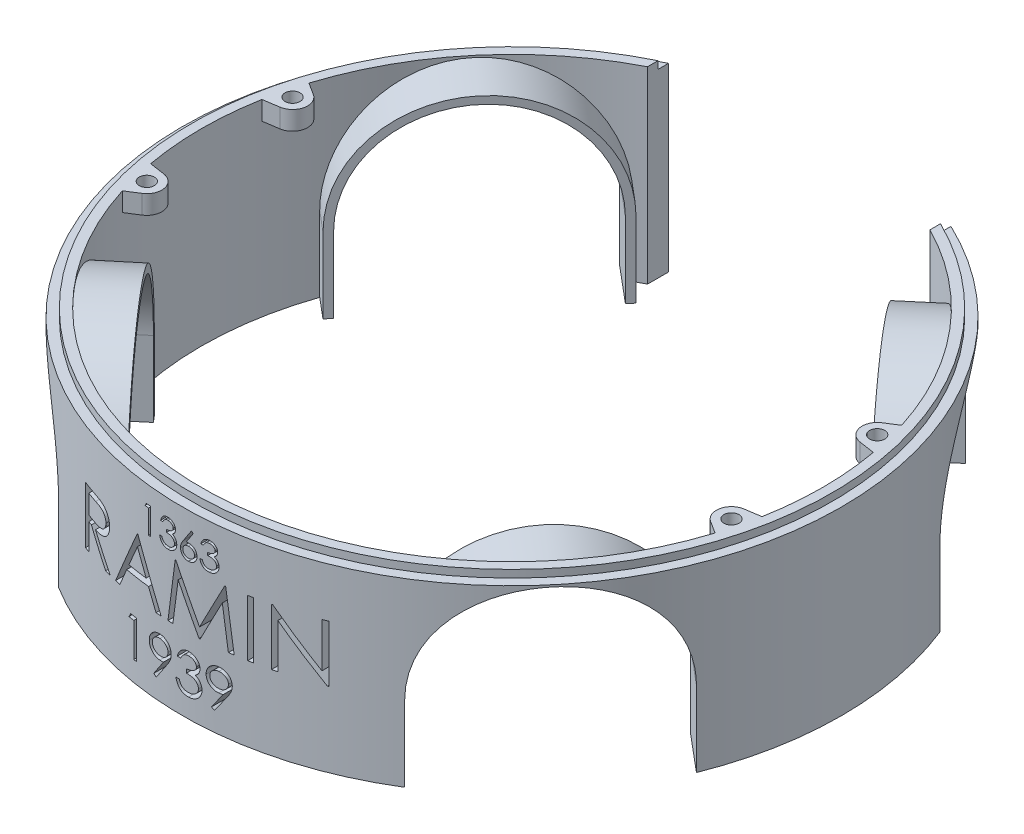
from build123d import *

# Parameters (mm, degrees)
SKETCH1_R                                     = 87.5
BOSS_EXTRUDE1_DEPTH                           = 50
SKETCH3_R                                     = 82.5
CUT_EXTRUDE1_DEPTH                            = 50
SKETCH6_W                                     = 75
SKETCH6_H                                     = 80.665083436
CUT_EXTRUDE2_DEPTH                            = 50
SKETCH7_R                                     = 2
BOSS_EXTRUDE10_DEPTH                          = 5
MIRROR1_AT_THE_SECOND_PLANE_COPY_1_SKETC_R    = 2
MIRROR1_AT_THE_SECOND_PLANE_COPY_1_DEPTH      = 5
CUT_EXTRUDE3_DEPTH                            = 134.46347815
BOSS_EXTRUDE11_REACH                          = 201.927
BOSS_EXTRUDE11_END_RADIUS                     = 82.5
MIRROR2_AT_THE_SECOND_PLANE_COPY_1_DEPTH      = 134.46347815
MIRROR2_AT_THE_SECOND_PLANE_COPY_2_REACH      = 201.927
MIRROR2_AT_THE_SECOND_PLANE_COPY_2_END_RADIUS = 82.5
CUT_EXTRUDE4_START                            = -2
SKETCH13_R                                    = 87.5
SKETCH13_R_2                                  = 85
CUT_EXTRUDE4_DEPTH                            = 2
SKETCH16_W                                    = 1.346153846
SKETCH16_H                                    = 15
CUT_EXTRUDE9_DEPTH                            = 10000


with BuildPart() as part:
    # Sketch1 → Boss-Extrude1 (new body)
    with BuildSketch(Plane(origin=(0, 0, 0), x_dir=(1, 0, 0), z_dir=(0, 1, 0))):
        with Locations(Location((0, 0, 0), (0, 0, 270))):
            Circle(SKETCH1_R)
    extrude(amount=BOSS_EXTRUDE1_DEPTH)

    # Sketch3 → Cut-Extrude1 (cut)
    with BuildSketch(Plane(origin=(0, 50, 0), x_dir=(1, 0, 0), z_dir=(0, 1, 0))):
        with Locations(Location((0, 0, 0), (0, 0, 270))):
            Circle(SKETCH3_R)
    extrude(amount=-CUT_EXTRUDE1_DEPTH, mode=Mode.SUBTRACT)

    # Sketch6 → Cut-Extrude2 (cut)
    with BuildSketch(Plane(origin=(0, 50, 0), x_dir=(1, 0, 0), z_dir=(0, 1, 0))):
        with Locations((0, 79.056941504)):
            Rectangle(SKETCH6_W, SKETCH6_H)
    extrude(amount=-CUT_EXTRUDE2_DEPTH, mode=Mode.SUBTRACT)

    # Sketch7 → Boss-Extrude10 (add)
    with BuildSketch(Plane(origin=(0, 50, 0), x_dir=(1, 0, 0), z_dir=(0, 1, 0))):
        with BuildLine():
            Line((-77.02286612, 15.399127899), (-81.167181464, 14.769517704))
            ThreePointArc((-81.167181464, 14.769517704), (-80.086745592, 19.808159443), (-78.693843423, 24.769517704))
            Line((-78.693843423, 24.769517704), (-75.481017933, 22.731486556))
            ThreePointArc((-75.481017933, 22.731486556), (-73.709264681, 18.530633102), (-77.02286612, 15.399127899))
        make_face()
        with Locations(Location((-77.623658102, 19.353751648, 0), (0, 0, 270))):
            Circle(SKETCH7_R, mode=Mode.SUBTRACT)
    boss_extrude10 = extrude(amount=-BOSS_EXTRUDE10_DEPTH)

    # Mirror1: Boss-Extrude10 across plane
    add(boss_extrude10.mirror(Plane(origin=(0, 0, 0), x_dir=(0, 0, 1), z_dir=(1, 0, 0))))

    # Mirror1 at the second plane: Boss-Extrude10 across plane
    add(boss_extrude10.mirror(Plane.XY))

    # Mirror1 at the second plane copy 1 sketc → Mirror1 at the second plane copy 1 (add)
    with BuildSketch(Plane(origin=(0, 50, 0), x_dir=(-1, 0, 0), z_dir=(0, 1, 0))):
        with BuildLine():
            Line((-77.02286612, 15.399127899), (-81.167181464, 14.769517704))
            ThreePointArc((-81.167181464, 14.769517704), (-80.086745592, 19.808159443), (-78.693843423, 24.769517704))
            Line((-78.693843423, 24.769517704), (-75.481017933, 22.731486556))
            ThreePointArc((-75.481017933, 22.731486556), (-73.709264681, 18.530633102), (-77.02286612, 15.399127899))
        make_face()
        with Locations(Location((-77.623658102, 19.353751648, 0), (0, 0, 270))):
            Circle(MIRROR1_AT_THE_SECOND_PLANE_COPY_1_SKETC_R, mode=Mode.SUBTRACT)
    extrude(amount=-MIRROR1_AT_THE_SECOND_PLANE_COPY_1_DEPTH)

    # Sketch9 → Cut-Extrude3 (cut, through all)
    with BuildSketch(Plane(origin=(0, 0, 0), x_dir=(0, 1, 0), z_dir=(0.7660444431189792, 0, 0.6427876096865379))):
        with BuildLine():
            Line((20, 27.5), (0, 27.5))
            Line((0, 27.5), (0, -27.5))
            Line((0, -27.5), (20, -27.5))
            ThreePointArc((20, -27.5), (47.5, 0), (20, 27.5))
        make_face()
    cut_extrude3 = extrude(amount=-CUT_EXTRUDE3_DEPTH, mode=Mode.SUBTRACT)

    # Boss-Extrude11: up to this cylinder (the profile starts inside it)
    boss_extrude11_end = Plane(origin=(0, 10, 0), z_dir=(0, 1, 0)) * Cylinder(BOSS_EXTRUDE11_END_RADIUS, 569.854, mode=Mode.PRIVATE)
    # Sketch10 → Boss-Extrude11 (add, up to the surface)
    with BuildSketch(Plane(origin=(-53.623111018, 0, -44.995132678), x_dir=(0, 1, 0), z_dir=(0.7660444431189792, 0, 0.6427876096865379)), mode=Mode.PRIVATE) as boss_extrude11_sk1:
        with BuildLine():
            Line((20, -27.5), (0, -27.5))
            Line((0, -27.5), (0, -29.5))
            Line((0, -29.5), (20, -29.5))
            ThreePointArc((20, -29.5), (49.5, 0), (20, 29.5))
            Line((20, 29.5), (0, 29.5))
            Line((0, 29.5), (0, 27.5))
            Line((0, 27.5), (20, 27.5))
            ThreePointArc((20, 27.5), (47.5, 0), (20, -27.5))
        make_face()
    boss_extrude11_tool1 = extrude(boss_extrude11_sk1.sketch, amount=-BOSS_EXTRUDE11_REACH, mode=Mode.PRIVATE) & boss_extrude11_end
    boss_extrude11 = boss_extrude11_tool1.solids().sort_by_distance((-72.090305, 10, -22.986788))[0]
    add(boss_extrude11)

    # Mirror2: Cut-Extrude3, Boss-Extrude11 across plane
    add(cut_extrude3.mirror(Plane.XY), mode=Mode.SUBTRACT)
    add(boss_extrude11.mirror(Plane.XY))

    # Mirror2 at the second plane: Cut-Extrude3, Boss-Extrude11 across plane
    add(cut_extrude3.mirror(Plane(origin=(0, 0, 0), x_dir=(0, 0, 1), z_dir=(1, 0, 0))), mode=Mode.SUBTRACT)
    add(boss_extrude11.mirror(Plane(origin=(0, 0, 0), x_dir=(0, 0, 1), z_dir=(1, 0, 0))))

    # Mirror2 at the second plane copy 1 sketc → Mirror2 at the second plane copy 1 (cut, through all)
    with BuildSketch(Plane(origin=(0, 0, 0), x_dir=(0, 1, 0), z_dir=(-0.7660444431189792, 0, -0.6427876096865379))):
        with BuildLine():
            Line((20, 27.5), (0, 27.5))
            Line((0, 27.5), (0, -27.5))
            Line((0, -27.5), (20, -27.5))
            ThreePointArc((20, -27.5), (47.5, 0), (20, 27.5))
        make_face()
    extrude(amount=-MIRROR2_AT_THE_SECOND_PLANE_COPY_1_DEPTH, mode=Mode.SUBTRACT)

    # Mirror2 at the second plane copy 2: up to this cylinder (the profile starts inside it)
    mirror2_at_the_second_plane_copy_2_end = Plane(origin=(0, 10, 0), z_dir=(0, 1, 0)) * Cylinder(MIRROR2_AT_THE_SECOND_PLANE_COPY_2_END_RADIUS, 569.854, mode=Mode.PRIVATE)
    # Mirror2 at the second plane copy 2 sketc → Mirror2 at the second plane copy 2 (add, up to the surface)
    with BuildSketch(Plane(origin=(53.623111018, 0, 44.995132678), x_dir=(0, 1, 0), z_dir=(-0.7660444431189792, 0, -0.6427876096865379)), mode=Mode.PRIVATE) as mirror2_at_the_second_plane_copy_2_sk1:
        with BuildLine():
            Line((20, -27.5), (0, -27.5))
            Line((0, -27.5), (0, -29.5))
            Line((0, -29.5), (20, -29.5))
            ThreePointArc((20, -29.5), (49.5, 0), (20, 29.5))
            Line((20, 29.5), (0, 29.5))
            Line((0, 29.5), (0, 27.5))
            Line((0, 27.5), (20, 27.5))
            ThreePointArc((20, 27.5), (47.5, 0), (20, -27.5))
        make_face()
    mirror2_at_the_second_plane_copy_2_tool1 = extrude(mirror2_at_the_second_plane_copy_2_sk1.sketch, amount=-MIRROR2_AT_THE_SECOND_PLANE_COPY_2_REACH, mode=Mode.PRIVATE) & mirror2_at_the_second_plane_copy_2_end
    add(mirror2_at_the_second_plane_copy_2_tool1.solids().sort_by_distance((-72.090305, 10, -22.986788))[0])

    # Sketch13 → Cut-Extrude4 (cut)
    with BuildSketch(Plane(origin=(0, 50, 0), x_dir=(1, 0, 0), z_dir=(0, 1, 0)).offset(CUT_EXTRUDE4_START)):
        Circle(SKETCH13_R)
        Circle(SKETCH13_R_2, mode=Mode.SUBTRACT)
    extrude(amount=CUT_EXTRUDE4_DEPTH, mode=Mode.SUBTRACT)

    # Sketch16 → Cut-Extrude9 (cut)
    # profile 1 of 13: a face of its own
    with BuildSketch(Plane.XY):
        with BuildLine():
            Line((-31.63045144, 34.8737665), (-28.628648556, 34.8737665))
            add(Edge.make_bspline(
                [(-28.628648556, 34.8737665), (-28.428329433, 34.873099703), (-28.043694529, 34.871819379), (-27.492666227, 34.864680395), (-26.991978669, 34.84421887), (-26.541893643, 34.826610655), (-26.142419407, 34.794502335), (-25.792331018, 34.763813848), (-25.493240886, 34.723641016), (-25.312187238, 34.68633206), (-25.230211056, 34.669439577)],
                knots=[0, 0, 0, 0, 1.410062039, 2.707475311, 3.878576406, 4.937260626, 5.877586885, 6.699081471, 7.410979367, 8, 8, 8, 8], degree=3))
            add(Edge.make_bspline(
                [(-25.230211056, 34.669439577), (-25.120468381, 34.642324868), (-24.90332414, 34.588673881), (-24.590681, 34.475275592), (-24.292762469, 34.344048629), (-24.010806079, 34.189918399), (-23.746224116, 34.011740772), (-23.496288499, 33.812591676), (-23.259865084, 33.593560794), (-23.046515241, 33.349125759), (-22.845347876, 33.092683575), (-22.675682334, 32.81538176), (-22.529425992, 32.525403785), (-22.41298092, 32.219800566), (-22.319218176, 31.901535829), (-22.253105722, 31.5677267), (-22.213457775, 31.21989395), (-22.209421251, 30.982645769), (-22.207374517, 30.862348231)],
                knots=[0, 0, 0, 0, 1.027469482, 2.033020251, 3.019912614, 3.986113645, 4.951240523, 5.91722682, 6.890402269, 7.87763091, 8.8651537, 9.85103654, 10.82876324, 11.815024772, 12.821070561, 13.842952187, 14.906261191, 16, 16, 16, 16], degree=3))
            add(Edge.make_bspline(
                [(-22.207374517, 30.862348231), (-22.213670223, 30.662483497), (-22.225954777, 30.272495634), (-22.340490935, 29.706520428), (-22.528104591, 29.178566223), (-22.786632973, 28.689297775), (-23.115859297, 28.248252152), (-23.511536973, 27.860864486), (-23.973886737, 27.536693432), (-24.404298091, 27.311895698), (-24.784501804, 27.167926089), (-25.097501716, 27.066627408), (-25.438931619, 26.988361843), (-25.805520196, 26.918246992), (-26.198793006, 26.865311159), (-26.61780746, 26.82654004), (-27.062862396, 26.802308403), (-27.368601264, 26.79869981), (-27.525884132, 26.796843423)],
                knots=[0, 0, 0, 0, 1.260483769, 2.459530307, 3.627416485, 4.787058657, 5.939039949, 7.08810263, 8.267026773, 9.491475466, 10.141966685, 10.831826277, 11.566392101, 12.351337768, 13.187381173, 14.07005841, 15.007169909, 16, 16, 16, 16], degree=3))
            Line((-27.525884132, 26.796843423), (-22.015066825, 19.8737665))
            Line((-22.015066825, 19.8737665), (-23.679730286, 19.8737665))
            Line((-23.679730286, 19.8737665), (-29.190547594, 26.796843423))
            Line((-29.190547594, 26.796843423), (-30.284297594, 26.796843423))
            Line((-30.284297594, 26.796843423), (-30.284297594, 19.8737665))
            Line((-30.284297594, 19.8737665), (-31.63045144, 19.8737665))
            Line((-31.63045144, 19.8737665), (-31.63045144, 34.8737665))
        make_face()
        with BuildLine():
            Line((-30.284297594, 33.335304962), (-30.284297594, 28.335304962))
            Line((-30.284297594, 28.335304962), (-27.537903363, 28.314271308))
            add(Edge.make_bspline(
                [(-27.537903363, 28.314271308), (-27.409674625, 28.314214579), (-27.161130809, 28.314104623), (-26.801556531, 28.331220807), (-26.466756052, 28.350692171), (-26.158009972, 28.38047508), (-25.875180363, 28.418858245), (-25.618408592, 28.466871035), (-25.387275513, 28.522808446), (-25.117710348, 28.609386842), (-24.816696642, 28.746555492), (-24.489561814, 28.946121915), (-24.210980367, 29.197132426), (-23.9756181, 29.484161523), (-23.786491965, 29.799745447), (-23.653154589, 30.140101315), (-23.568544122, 30.496636735), (-23.558564641, 30.741685768), (-23.553528363, 30.865353039)],
                knots=[0, 0, 0, 0, 1.146690395, 2.22261258, 3.21895312, 4.145990853, 4.996080663, 5.770904154, 6.481378293, 7.121626537, 8.300444488, 9.431385265, 10.535395872, 11.636531494, 12.74115979, 13.810798291, 14.895190096, 16, 16, 16, 16], degree=3))
            add(Edge.make_bspline(
                [(-23.553528363, 30.865353039), (-23.558680311, 30.985981212), (-23.568889591, 31.225022235), (-23.652241456, 31.574976136), (-23.793195947, 31.905263065), (-23.983148396, 32.214539429), (-24.214573346, 32.495278297), (-24.4859354, 32.735480382), (-24.789814808, 32.933692373), (-25.073834229, 33.060354004), (-25.32769514, 33.138010518), (-25.548107969, 33.192658363), (-25.797157159, 33.23656323), (-26.076051982, 33.271740633), (-26.383601828, 33.301976109), (-26.721361761, 33.322340874), (-27.087090819, 33.334400292), (-27.340577667, 33.334996387), (-27.471797594, 33.335304962)],
                knots=[0, 0, 0, 0, 1.101028733, 2.181837193, 3.264309656, 4.369019818, 5.486613113, 6.575447106, 7.666700264, 8.788928104, 9.402425223, 10.0903467, 10.862060571, 11.710948788, 12.657782767, 13.684531032, 14.801375019, 16, 16, 16, 16], degree=3))
            Line((-27.471797594, 33.335304962), (-30.284297594, 33.335304962))
        make_face(mode=Mode.SUBTRACT)
    # profile 2 of 13: a face of its own
    with BuildSketch(Plane.XY):
        Polygon((-12.784297594, 34.8737665), (-5.861220671, 19.8737665), (-7.324562017, 19.8737665), (-9.542110094, 24.681458808), (-16.341989902, 24.681458808), (-18.62263894, 19.8737665), (-20.091989902, 19.8737665), (-12.976605286, 34.8737665), align=None)
        Polygon((-12.895475479, 31.950088615), (-15.611821632, 26.219920346), (-10.251244709, 26.219920346), align=None, mode=Mode.SUBTRACT)
    # profile 3 of 13: a face of its own
    with BuildSketch(Plane.XY):
        Polygon((-3.938143748, 19.8737665), (-1.957975479, 34.8737665), (-1.765667786, 34.8737665), (4.427240868, 22.566074192), (10.605125483, 34.8737665), (10.800437983, 34.8737665), (12.792625483, 19.8737665), (11.440462021, 19.8737665), (10.004163944, 30.667035731), (4.589500483, 19.8737665), (4.286014906, 19.8737665), (-1.149682209, 30.691074192), (-2.582975479, 19.8737665), align=None)
    # profile 4 of 13: a face of its own
    with BuildSketch(Plane.XY):
        with Locations((16.542625483, 27.3737665)):
            Rectangle(SKETCH16_W, SKETCH16_H)
    # profile 5 of 13: a face of its own
    with BuildSketch(Plane.XY):
        Polygon((21.061856252, 19.8737665), (21.061856252, 34.8737665), (21.344308175, 34.8737665), (31.254163944, 23.067877077), (31.254163944, 34.8737665), (32.600317791, 34.8737665), (32.600317791, 19.8737665), (32.293827406, 19.8737665), (22.408010098, 31.652612654), (22.408010098, 19.8737665), align=None)
    # profile 6 of 13: a face of its own
    with BuildSketch(Plane.XY):
        Polygon((-10.1731322, 43.464122191), (-8.878861367, 43.464122191), (-8.878861367, 36.464122191), (-9.507066495, 36.464122191), (-9.507066495, 42.746173473), (-10.583989572, 42.746173473), align=None)
    # profile 7 of 13: a face of its own
    with BuildSketch(Plane.XY):
        with BuildLine():
            Line((-5.378861367, 41.848737575), (-6.007066495, 41.848737575))
            add(Edge.make_bspline(
                [(-6.007066495, 41.848737575), (-5.990047394, 41.919202543), (-5.956776442, 42.056955792), (-5.887381296, 42.253770314), (-5.811782785, 42.440017357), (-5.721004576, 42.612209504), (-5.621987068, 42.773807309), (-5.508541624, 42.921145558), (-5.385902179, 43.057971489), (-5.250252281, 43.179397964), (-5.107994957, 43.289353423), (-4.957125718, 43.383103538), (-4.800679931, 43.463751843), (-4.637573665, 43.530192307), (-4.467321321, 43.580243354), (-4.291462075, 43.616556966), (-4.109535074, 43.640139194), (-3.986039893, 43.64244072), (-3.923332521, 43.64360937)],
                knots=[0, 0, 0, 0, 1.162005537, 2.271625781, 3.343758855, 4.383309926, 5.390229558, 6.379919256, 7.361854164, 8.333198761, 9.295911338, 10.242430842, 11.177959212, 12.116337295, 13.062827104, 14.020064771, 14.994644689, 16, 16, 16, 16], degree=3))
            add(Edge.make_bspline(
                [(-3.923332521, 43.64360937), (-3.831967036, 43.64085091), (-3.651229015, 43.635394159), (-3.385702921, 43.585565286), (-3.129649282, 43.506715021), (-2.885870787, 43.397767567), (-2.659433922, 43.263392941), (-2.457961548, 43.103463467), (-2.284184527, 42.921064864), (-2.138395771, 42.719599735), (-2.024245773, 42.504288716), (-1.940073026, 42.282688402), (-1.888829664, 42.055324459), (-1.882188551, 41.901809901), (-1.878861367, 41.824899434)],
                knots=[0, 0, 0, 0, 1.083050992, 2.142477498, 3.193116406, 4.255571735, 5.30263384, 6.308962982, 7.297363603, 8.282367274, 9.249857812, 10.179914175, 11.08814088, 12, 12, 12, 12], degree=3))
            add(Edge.make_bspline(
                [(-1.878861367, 41.824899434), (-1.881188549, 41.750885845), (-1.885742483, 41.606052736), (-1.924409894, 41.394609742), (-1.98948242, 41.195326541), (-2.079621945, 41.007364217), (-2.196305046, 40.831914537), (-2.337650439, 40.668582756), (-2.504655763, 40.516644439), (-2.631213639, 40.429605493), (-2.69636938, 40.384795268)],
                knots=[0, 0, 0, 0, 1.024540389, 2.004866551, 2.965041327, 3.920577974, 4.882998113, 5.874504559, 6.905732034, 8, 8, 8, 8], degree=3))
            add(Edge.make_bspline(
                [(-2.69636938, 40.384795268), (-2.62190587, 40.348838925), (-2.474372122, 40.277599009), (-2.273271063, 40.137887494), (-2.090715312, 39.9765748), (-1.988907874, 39.850689494), (-1.937755598, 39.787439498)],
                knots=[0, 0, 0, 0, 1.015518401, 2.012035669, 3.001164323, 4, 4, 4, 4], degree=3))
            add(Edge.make_bspline(
                [(-1.937755598, 39.787439498), (-1.904072913, 39.741323995), (-1.837259121, 39.649848162), (-1.754788053, 39.50277531), (-1.679969825, 39.354072332), (-1.621669386, 39.19975352), (-1.576521652, 39.041607492), (-1.544249588, 38.8793627), (-1.524201306, 38.712886655), (-1.521330202, 38.600261695), (-1.519887008, 38.543649434)],
                knots=[0, 0, 0, 0, 1.025084078, 2.033381695, 3.024893161, 4.013698104, 4.991890475, 5.976764909, 6.982997093, 8, 8, 8, 8], degree=3))
            add(Edge.make_bspline(
                [(-1.519887008, 38.543649434), (-1.523476035, 38.445629992), (-1.530637199, 38.250052388), (-1.594645347, 37.961102945), (-1.693871829, 37.67865194), (-1.834785701, 37.408502262), (-2.006520718, 37.1557415), (-2.210835367, 36.929588882), (-2.445408184, 36.735191673), (-2.707019481, 36.572771217), (-2.990453738, 36.442935373), (-3.293604922, 36.352820487), (-3.61210503, 36.294128488), (-3.830519625, 36.28783475), (-3.941561687, 36.284635011)],
                knots=[0, 0, 0, 0, 0.955779014, 1.907060117, 2.875433937, 3.871313158, 4.872415639, 5.851225146, 6.836215519, 7.83643374, 8.849228613, 9.86973379, 10.916971861, 12, 12, 12, 12], degree=3))
            add(Edge.make_bspline(
                [(-3.941561687, 36.284635011), (-4.016400288, 36.286371438), (-4.163657698, 36.289788146), (-4.380144695, 36.313145349), (-4.586788093, 36.355805359), (-4.783867289, 36.41321197), (-4.971557362, 36.485995454), (-5.149285572, 36.57663285), (-5.318145359, 36.683255854), (-5.476543262, 36.80712303), (-5.624460397, 36.945685709), (-5.757965846, 37.101403729), (-5.879285431, 37.271398537), (-5.985170709, 37.457644649), (-6.080444614, 37.657735164), (-6.158806527, 37.874232161), (-6.227777665, 38.105200205), (-6.259844593, 38.266155685), (-6.276297264, 38.348737575)],
                knots=[0, 0, 0, 0, 1.048658725, 2.063410685, 3.046034179, 4.001477787, 4.936774919, 5.862367409, 6.792675028, 7.730719943, 8.675894397, 9.627829632, 10.600096036, 11.597688215, 12.626045268, 13.701542398, 14.82072376, 16, 16, 16, 16], degree=3))
            Line((-6.276297264, 38.348737575), (-5.648092136, 38.348737575))
            add(Edge.make_bspline(
                [(-5.648092136, 38.348737575), (-5.631725553, 38.294839549), (-5.599891128, 38.190003206), (-5.545702532, 38.039122594), (-5.483965988, 37.900806488), (-5.41773687, 37.774040244), (-5.348179978, 37.657575439), (-5.270350128, 37.554491701), (-5.190011838, 37.460261296), (-5.129453131, 37.407172073), (-5.099814892, 37.381189498)],
                knots=[0, 0, 0, 0, 1.198163088, 2.33053128, 3.407730985, 4.417276592, 5.372219308, 6.28897303, 7.162600585, 8, 8, 8, 8], degree=3))
            add(Edge.make_bspline(
                [(-5.099814892, 37.381189498), (-5.060621739, 37.350972831), (-4.982356414, 37.290632767), (-4.854819951, 37.21362951), (-4.720690179, 37.146907459), (-4.577060831, 37.095940068), (-4.42703129, 37.052784746), (-4.268176559, 37.024543708), (-4.101898125, 37.005167365), (-3.988362598, 37.003457502), (-3.930343739, 37.002583729)],
                knots=[0, 0, 0, 0, 0.946170439, 1.889420265, 2.845303464, 3.807233317, 4.801018734, 5.828864929, 6.890507805, 8, 8, 8, 8], degree=3))
            add(Edge.make_bspline(
                [(-3.930343739, 37.002583729), (-3.864836733, 37.00381554), (-3.736743439, 37.006224239), (-3.549833721, 37.028375652), (-3.372018826, 37.060636479), (-3.205272974, 37.110462445), (-3.047411959, 37.172024148), (-2.90064866, 37.249320959), (-2.763056448, 37.340010402), (-2.636397637, 37.443088719), (-2.522506622, 37.55593171), (-2.422227595, 37.673957852), (-2.336978272, 37.796669511), (-2.268211116, 37.924745753), (-2.213910015, 38.05765621), (-2.176943614, 38.195773869), (-2.151240584, 38.337968401), (-2.14914736, 38.434626339), (-2.148092136, 38.48335296)],
                knots=[0, 0, 0, 0, 1.217147791, 2.380027433, 3.494444702, 4.572153297, 5.609568379, 6.639424714, 7.649109417, 8.668170816, 9.669597737, 10.625200337, 11.543417969, 12.441394052, 13.322311151, 14.205496177, 15.095365482, 16, 16, 16, 16], degree=3))
            add(Edge.make_bspline(
                [(-2.148092136, 38.48335296), (-2.151152739, 38.548575638), (-2.157258716, 38.678696454), (-2.203875875, 38.870131603), (-2.280553603, 39.054578428), (-2.387898626, 39.228890008), (-2.518570083, 39.390441811), (-2.671299897, 39.534584776), (-2.847356354, 39.653524958), (-3.009396092, 39.735702271), (-3.152926405, 39.791776421), (-3.275757174, 39.82912635), (-3.41327038, 39.860753661), (-3.563803078, 39.890178204), (-3.728489511, 39.915220901), (-3.907150387, 39.936104532), (-4.09982191, 39.952814614), (-4.233204242, 39.960276805), (-4.30193829, 39.964122191)],
                knots=[0, 0, 0, 0, 1.07054697, 2.135767047, 3.216561865, 4.33974944, 5.486079747, 6.621378074, 7.775625952, 8.963672916, 9.598146892, 10.304877434, 11.070270905, 11.915000392, 12.823868403, 13.805723172, 14.86925407, 16, 16, 16, 16], degree=3))
            Line((-4.30193829, 39.964122191), (-4.30193829, 40.682070909))
            add(Edge.make_bspline(
                [(-4.30193829, 40.682070909), (-4.215335958, 40.683540516), (-4.045703265, 40.686419116), (-3.797914656, 40.721235137), (-3.560968031, 40.769396393), (-3.340114547, 40.843166778), (-3.138817121, 40.928847371), (-2.964177917, 41.02855179), (-2.818643622, 41.139381289), (-2.702921479, 41.263046507), (-2.615863022, 41.395676602), (-2.552209427, 41.533909918), (-2.514608774, 41.67895804), (-2.509589441, 41.777947376), (-2.507066495, 41.827703922)],
                knots=[0, 0, 0, 0, 1.321986639, 2.589447074, 3.816329219, 5.01088745, 6.139805852, 7.153945165, 8.075214402, 8.924034688, 9.728124013, 10.488707548, 11.240355623, 12, 12, 12, 12], degree=3))
            add(Edge.make_bspline(
                [(-2.507066495, 41.827703922), (-2.507895317, 41.864259412), (-2.509544219, 41.936984826), (-2.530338774, 42.043234963), (-2.561586856, 42.146236855), (-2.604546315, 42.245552476), (-2.662046712, 42.340493024), (-2.730858685, 42.431867921), (-2.812794886, 42.519155479), (-2.90668578, 42.600516119), (-3.00750939, 42.678054593), (-3.11800894, 42.743881867), (-3.234852689, 42.800171991), (-3.358169999, 42.846590995), (-3.48836106, 42.881509572), (-3.624814175, 42.906581254), (-3.767789542, 42.922256564), (-3.865333006, 42.924513396), (-3.914919059, 42.925660652)],
                knots=[0, 0, 0, 0, 0.884392785, 1.759457502, 2.611959086, 3.489218968, 4.37281399, 5.2945488, 6.255912374, 7.266815255, 8.301784654, 9.332968512, 10.37626691, 11.440494194, 12.520033166, 13.637162961, 14.798855837, 16, 16, 16, 16], degree=3))
            add(Edge.make_bspline(
                [(-3.914919059, 42.925660652), (-3.994622395, 42.922877928), (-4.150301548, 42.917442621), (-4.374731382, 42.869836594), (-4.58337005, 42.793880427), (-4.742847383, 42.703214388), (-4.860612531, 42.613713521), (-4.944766408, 42.535548748), (-5.027407428, 42.448683101), (-5.103098782, 42.34776635), (-5.179646735, 42.23963277), (-5.249335858, 42.118785407), (-5.317055243, 41.988376618), (-5.357860342, 41.896185349), (-5.378861367, 41.848737575)],
                knots=[0, 0, 0, 0, 1.472543308, 2.876219568, 4.221790263, 5.565193594, 6.249813518, 6.953379497, 7.687249741, 8.463570142, 9.283606569, 10.136032583, 11.040678096, 12, 12, 12, 12], degree=3))
        make_face()
    # profile 8 of 13: a face of its own
    with BuildSketch(Plane.XY):
        with BuildLine():
            Line((2.339087351, 43.64360937), (2.82286139, 43.263601357))
            Line((2.82286139, 43.263601357), (0.973302095, 40.435276037))
            add(Edge.make_bspline(
                [(0.973302095, 40.435276037), (1.096442649, 40.454903758), (1.336642222, 40.493189848), (1.579774019, 40.499505739), (1.698262031, 40.502583729)],
                knots=[0, 0, 0, 0, 1.025318673, 2, 2, 2, 2], degree=3))
            add(Edge.make_bspline(
                [(1.698262031, 40.502583729), (1.769407023, 40.500671506), (1.909453824, 40.496907351), (2.115067429, 40.46793965), (2.312645301, 40.422289426), (2.501368525, 40.355744914), (2.681914489, 40.270740205), (2.855319281, 40.168862465), (3.018323301, 40.044851104), (3.17302566, 39.906321192), (3.313479854, 39.752887223), (3.437831966, 39.59008455), (3.542285549, 39.418082788), (3.627033392, 39.236969056), (3.692843149, 39.047022537), (3.74081844, 38.848486258), (3.769177625, 38.641223315), (3.773028607, 38.500266964), (3.774984787, 38.42866546)],
                knots=[0, 0, 0, 0, 1.04369286, 2.054478336, 3.041073146, 4.015093852, 4.984733326, 5.965804835, 6.960378782, 7.985147595, 9.009457201, 10.008161701, 10.986880575, 11.956520048, 12.937015923, 13.931873656, 14.949455224, 16, 16, 16, 16], degree=3))
            add(Edge.make_bspline(
                [(3.774984787, 38.42866546), (3.772138577, 38.330706052), (3.76653791, 38.13794512), (3.710730318, 37.857191707), (3.624011029, 37.589726676), (3.500055972, 37.339820334), (3.346091206, 37.107815194), (3.15833602, 36.902244264), (2.943449044, 36.718904189), (2.700475447, 36.565590951), (2.438989519, 36.440384849), (2.164285524, 36.350454364), (1.879031232, 36.295087426), (1.685422016, 36.28814622), (1.587484787, 36.284635011)],
                knots=[0, 0, 0, 0, 1.031375318, 2.029502543, 3.004789286, 3.987476834, 4.960371455, 5.9300674, 6.912260825, 7.929083631, 8.949397511, 9.960523116, 10.96833055, 12, 12, 12, 12], degree=3))
            add(Edge.make_bspline(
                [(1.587484787, 36.284635011), (1.493291386, 36.287691423), (1.30671075, 36.293745639), (1.032245161, 36.347677515), (0.768519127, 36.43509172), (0.517380365, 36.555520277), (0.284739139, 36.707636043), (0.076607866, 36.890760601), (-0.105975683, 37.100979531), (-0.257924925, 37.338260226), (-0.378442389, 37.593240141), (-0.468822239, 37.859114454), (-0.521614725, 38.134914417), (-0.528991839, 38.321876696), (-0.532707521, 38.416045268)],
                knots=[0, 0, 0, 0, 1.012016664, 2.004627821, 2.994792927, 3.992885782, 4.990978636, 5.973936114, 6.964471063, 7.975201453, 8.993600317, 9.990122807, 10.98767138, 12, 12, 12, 12], degree=3))
            add(Edge.make_bspline(
                [(-0.532707521, 38.416045268), (-0.530344631, 38.488134434), (-0.525520061, 38.635326738), (-0.49183328, 38.858254794), (-0.43770369, 39.086356957), (-0.377083198, 39.279865345), (-0.313031978, 39.438388389), (-0.259726898, 39.56619537), (-0.193378906, 39.697717516), (-0.122632144, 39.837464788), (-0.041118406, 39.981835654), (0.047512893, 40.133242993), (0.145712194, 40.289278848), (0.21455252, 40.395167238), (0.249744402, 40.449298473)],
                knots=[0, 0, 0, 0, 1.173818275, 2.396712641, 3.66331629, 4.989737886, 5.693666774, 6.447286557, 7.243889047, 8.091586357, 8.998013824, 9.943181721, 10.948533338, 12, 12, 12, 12], degree=3))
            Line((0.249744402, 40.449298473), (2.339087351, 43.64360937))
        make_face()
        with BuildLine():
            add(Edge.make_bspline(
                [(1.566451133, 39.784635011), (1.513126644, 39.783078924), (1.408968425, 39.780039433), (1.256153595, 39.762388929), (1.111527092, 39.729150798), (0.973172825, 39.686818134), (0.843677419, 39.628612015), (0.72209974, 39.557908417), (0.607969636, 39.474666061), (0.502482532, 39.380064238), (0.406843206, 39.276488173), (0.324480944, 39.165549128), (0.253436144, 39.049920722), (0.195672506, 38.928636838), (0.150692355, 38.801743838), (0.118155853, 38.66982534), (0.10004835, 38.531996727), (0.097035887, 38.438531722), (0.095497608, 38.390804883)],
                knots=[0, 0, 0, 0, 1.129588631, 2.206414736, 3.251139165, 4.268635594, 5.265702196, 6.250456724, 7.242448911, 8.251968645, 9.246821453, 10.222880186, 11.173611482, 12.116736599, 13.062300278, 14.020270554, 14.989073742, 16, 16, 16, 16], degree=3))
            add(Edge.make_bspline(
                [(0.095497608, 38.390804883), (0.096750331, 38.343504923), (0.099206734, 38.250756744), (0.121511374, 38.114078385), (0.155581538, 37.982548568), (0.20626233, 37.85684537), (0.266716106, 37.735052734), (0.346526755, 37.621582163), (0.434960326, 37.509542023), (0.540668193, 37.40753908), (0.654114919, 37.312625832), (0.775317324, 37.229665325), (0.901637244, 37.158692978), (1.034780088, 37.103070783), (1.172856856, 37.057422209), (1.317017964, 37.025299251), (1.467363675, 37.007138199), (1.569207551, 37.004121811), (1.621138633, 37.002583729)],
                knots=[0, 0, 0, 0, 0.989467248, 1.94019797, 2.891935182, 3.827694429, 4.772920941, 5.730924762, 6.725747692, 7.756678648, 8.79901574, 9.819492441, 10.826891316, 11.826466727, 12.835195252, 13.867842842, 14.912794438, 16, 16, 16, 16], degree=3))
            add(Edge.make_bspline(
                [(1.621138633, 37.002583729), (1.67306963, 37.004121932), (1.774913339, 37.007138556), (1.92526026, 37.025297893), (2.069416897, 37.057427189), (2.207509914, 37.10305273), (2.340592777, 37.158759949), (2.46680222, 37.229223788), (2.586858407, 37.313136024), (2.700379606, 37.40737688), (2.805647482, 37.510122584), (2.89620204, 37.620582029), (2.973568507, 37.73596982), (3.036436881, 37.8563656), (3.086559463, 37.982624575), (3.120802398, 38.114058023), (3.143060976, 38.250762075), (3.145523708, 38.343506724), (3.146779659, 38.390804883)],
                knots=[0, 0, 0, 0, 1.087397944, 2.132534446, 3.165364764, 4.174271784, 5.174024072, 6.181601208, 7.194203697, 8.236725232, 9.267838612, 10.269026844, 11.221737037, 12.171628256, 13.107553087, 14.05945871, 15.010357665, 16, 16, 16, 16], degree=3))
            add(Edge.make_bspline(
                [(3.146779659, 38.390804883), (3.145679073, 38.438593985), (3.143518981, 38.53238845), (3.119087083, 38.669763686), (3.085202336, 38.802414099), (3.034036274, 38.929505997), (2.967563185, 39.050537851), (2.886596371, 39.166121053), (2.79293123, 39.277141748), (2.684736151, 39.380267365), (2.566955683, 39.47456152), (2.441724512, 39.557800633), (2.310708565, 39.628050587), (2.17404068, 39.686664791), (2.030154915, 39.728963739), (1.881374236, 39.762270226), (1.725795751, 39.779994261), (1.620242534, 39.783068391), (1.566451133, 39.784635011)],
                knots=[0, 0, 0, 0, 0.978206639, 1.919901502, 2.851605144, 3.780102724, 4.718870031, 5.675451981, 6.667674623, 7.690630536, 8.733308323, 9.756129687, 10.767539656, 11.776269907, 12.797430371, 13.836405707, 14.897401972, 16, 16, 16, 16], degree=3))
        make_face(mode=Mode.SUBTRACT)
    # profile 9 of 13: a face of its own
    with BuildSketch(Plane.XY):
        with BuildLine():
            Line((5.390369402, 41.848737575), (4.762164274, 41.848737575))
            add(Edge.make_bspline(
                [(4.762164274, 41.848737575), (4.779183376, 41.919202543), (4.812454327, 42.056955792), (4.881849474, 42.253770314), (4.957447984, 42.440017357), (5.048226193, 42.612209504), (5.147243702, 42.773807309), (5.260689145, 42.921145558), (5.38332859, 43.057971489), (5.518978488, 43.179397964), (5.661235812, 43.289353423), (5.812105051, 43.383103538), (5.968550839, 43.463751843), (6.131657104, 43.530192307), (6.301909448, 43.580243354), (6.477768695, 43.616556966), (6.659695695, 43.640139194), (6.783190876, 43.64244072), (6.845898249, 43.64360937)],
                knots=[0, 0, 0, 0, 1.162005537, 2.271625781, 3.343758855, 4.383309926, 5.390229558, 6.379919256, 7.361854164, 8.333198761, 9.295911338, 10.242430842, 11.177959212, 12.116337295, 13.062827104, 14.020064771, 14.994644689, 16, 16, 16, 16], degree=3))
            add(Edge.make_bspline(
                [(6.845898249, 43.64360937), (6.937263733, 43.64085091), (7.118001755, 43.635394159), (7.383527849, 43.585565286), (7.639581487, 43.506715021), (7.883359982, 43.397767567), (8.109796848, 43.263392941), (8.311269221, 43.103463467), (8.485046243, 42.921064864), (8.630834998, 42.719599735), (8.744984996, 42.504288716), (8.829157743, 42.282688402), (8.880401105, 42.055324459), (8.887042219, 41.901809901), (8.890369402, 41.824899434)],
                knots=[0, 0, 0, 0, 1.083050992, 2.142477498, 3.193116406, 4.255571735, 5.30263384, 6.308962982, 7.297363603, 8.282367274, 9.249857812, 10.179914175, 11.08814088, 12, 12, 12, 12], degree=3))
            add(Edge.make_bspline(
                [(8.890369402, 41.824899434), (8.88804222, 41.750885845), (8.883488286, 41.606052736), (8.844820875, 41.394609742), (8.779748349, 41.195326541), (8.689608824, 41.007364217), (8.572925724, 40.831914537), (8.43158033, 40.668582756), (8.264575006, 40.516644439), (8.13801713, 40.429605493), (8.07286139, 40.384795268)],
                knots=[0, 0, 0, 0, 1.024540389, 2.004866551, 2.965041327, 3.920577974, 4.882998113, 5.874504559, 6.905732034, 8, 8, 8, 8], degree=3))
            add(Edge.make_bspline(
                [(8.07286139, 40.384795268), (8.147324899, 40.348838925), (8.294858647, 40.277599009), (8.495959706, 40.137887494), (8.678515457, 39.9765748), (8.780322895, 39.850689494), (8.831475172, 39.787439498)],
                knots=[0, 0, 0, 0, 1.015518401, 2.012035669, 3.001164323, 4, 4, 4, 4], degree=3))
            add(Edge.make_bspline(
                [(8.831475172, 39.787439498), (8.865157856, 39.741323995), (8.931971649, 39.649848162), (9.014442716, 39.50277531), (9.089260945, 39.354072332), (9.147561383, 39.19975352), (9.192709117, 39.041607492), (9.224981181, 38.8793627), (9.245029463, 38.712886655), (9.247900567, 38.600261695), (9.249343761, 38.543649434)],
                knots=[0, 0, 0, 0, 1.025084078, 2.033381695, 3.024893161, 4.013698104, 4.991890475, 5.976764909, 6.982997093, 8, 8, 8, 8], degree=3))
            add(Edge.make_bspline(
                [(9.249343761, 38.543649434), (9.245754734, 38.445629992), (9.23859357, 38.250052388), (9.174585422, 37.961102945), (9.07535894, 37.67865194), (8.934445068, 37.408502262), (8.762710051, 37.1557415), (8.558395402, 36.929588882), (8.323822586, 36.735191673), (8.062211288, 36.572771217), (7.778777031, 36.442935373), (7.475625847, 36.352820487), (7.157125739, 36.294128488), (6.938711144, 36.28783475), (6.827669082, 36.284635011)],
                knots=[0, 0, 0, 0, 0.955779014, 1.907060117, 2.875433937, 3.871313158, 4.872415639, 5.851225146, 6.836215519, 7.83643374, 8.849228613, 9.86973379, 10.916971861, 12, 12, 12, 12], degree=3))
            add(Edge.make_bspline(
                [(6.827669082, 36.284635011), (6.752830481, 36.286371438), (6.605573071, 36.289788146), (6.389086074, 36.313145349), (6.182442676, 36.355805359), (5.98536348, 36.41321197), (5.797673407, 36.485995454), (5.619945197, 36.57663285), (5.45108541, 36.683255854), (5.292687508, 36.80712303), (5.144770372, 36.945685709), (5.011264924, 37.101403729), (4.889945338, 37.271398537), (4.78406006, 37.457644649), (4.688786155, 37.657735164), (4.610424242, 37.874232161), (4.541453105, 38.105200205), (4.509386176, 38.266155685), (4.492933505, 38.348737575)],
                knots=[0, 0, 0, 0, 1.048658725, 2.063410685, 3.046034179, 4.001477787, 4.936774919, 5.862367409, 6.792675028, 7.730719943, 8.675894397, 9.627829632, 10.600096036, 11.597688215, 12.626045268, 13.701542398, 14.82072376, 16, 16, 16, 16], degree=3))
            Line((4.492933505, 38.348737575), (5.121138633, 38.348737575))
            add(Edge.make_bspline(
                [(5.121138633, 38.348737575), (5.137505216, 38.294839549), (5.169339641, 38.190003206), (5.223528238, 38.039122594), (5.285264782, 37.900806488), (5.351493899, 37.774040244), (5.421050791, 37.657575439), (5.498880641, 37.554491701), (5.579218932, 37.460261296), (5.639777638, 37.407172073), (5.669415877, 37.381189498)],
                knots=[0, 0, 0, 0, 1.198163088, 2.33053128, 3.407730985, 4.417276592, 5.372219308, 6.28897303, 7.162600585, 8, 8, 8, 8], degree=3))
            add(Edge.make_bspline(
                [(5.669415877, 37.381189498), (5.70860903, 37.350972831), (5.786874356, 37.290632767), (5.914410818, 37.21362951), (6.04854059, 37.146907459), (6.192169938, 37.095940068), (6.342199479, 37.052784746), (6.50105421, 37.024543708), (6.667332644, 37.005167365), (6.780868171, 37.003457502), (6.838887031, 37.002583729)],
                knots=[0, 0, 0, 0, 0.946170439, 1.889420265, 2.845303464, 3.807233317, 4.801018734, 5.828864929, 6.890507805, 8, 8, 8, 8], degree=3))
            add(Edge.make_bspline(
                [(6.838887031, 37.002583729), (6.904394036, 37.00381554), (7.03248733, 37.006224239), (7.219397048, 37.028375652), (7.397211944, 37.060636479), (7.563957795, 37.110462445), (7.72181881, 37.172024148), (7.868582109, 37.249320959), (8.006174321, 37.340010402), (8.132833132, 37.443088719), (8.246724147, 37.55593171), (8.347003174, 37.673957852), (8.432252497, 37.796669511), (8.501019653, 37.924745753), (8.555320754, 38.05765621), (8.592287155, 38.195773869), (8.617990185, 38.337968401), (8.62008341, 38.434626339), (8.621138633, 38.48335296)],
                knots=[0, 0, 0, 0, 1.217147791, 2.380027433, 3.494444702, 4.572153297, 5.609568379, 6.639424714, 7.649109417, 8.668170816, 9.669597737, 10.625200337, 11.543417969, 12.441394052, 13.322311151, 14.205496177, 15.095365482, 16, 16, 16, 16], degree=3))
            add(Edge.make_bspline(
                [(8.621138633, 38.48335296), (8.61807803, 38.548575638), (8.611972053, 38.678696454), (8.565354894, 38.870131603), (8.488677166, 39.054578428), (8.381332143, 39.228890008), (8.250660686, 39.390441811), (8.097930872, 39.534584776), (7.921874416, 39.653524958), (7.759834677, 39.735702271), (7.616304364, 39.791776421), (7.493473596, 39.82912635), (7.355960389, 39.860753661), (7.205427691, 39.890178204), (7.040741258, 39.915220901), (6.862080382, 39.936104532), (6.669408859, 39.952814614), (6.536026527, 39.960276805), (6.467292479, 39.964122191)],
                knots=[0, 0, 0, 0, 1.07054697, 2.135767047, 3.216561865, 4.33974944, 5.486079747, 6.621378074, 7.775625952, 8.963672916, 9.598146892, 10.304877434, 11.070270905, 11.915000392, 12.823868403, 13.805723172, 14.86925407, 16, 16, 16, 16], degree=3))
            Line((6.467292479, 39.964122191), (6.467292479, 40.682070909))
            add(Edge.make_bspline(
                [(6.467292479, 40.682070909), (6.553894811, 40.683540516), (6.723527504, 40.686419116), (6.971316113, 40.721235137), (7.208262738, 40.769396393), (7.429116222, 40.843166778), (7.630413648, 40.928847371), (7.805052853, 41.02855179), (7.950587147, 41.139381289), (8.06630929, 41.263046507), (8.153367747, 41.395676602), (8.217021342, 41.533909918), (8.254621995, 41.67895804), (8.259641329, 41.777947376), (8.262164274, 41.827703922)],
                knots=[0, 0, 0, 0, 1.321986639, 2.589447074, 3.816329219, 5.01088745, 6.139805852, 7.153945165, 8.075214402, 8.924034688, 9.728124013, 10.488707548, 11.240355623, 12, 12, 12, 12], degree=3))
            add(Edge.make_bspline(
                [(8.262164274, 41.827703922), (8.261335452, 41.864259412), (8.25968655, 41.936984826), (8.238891995, 42.043234963), (8.207643913, 42.146236855), (8.164684454, 42.245552476), (8.107184057, 42.340493024), (8.038372084, 42.431867921), (7.956435883, 42.519155479), (7.862544989, 42.600516119), (7.761721379, 42.678054593), (7.651221829, 42.743881867), (7.53437808, 42.800171991), (7.41106077, 42.846590995), (7.280869709, 42.881509572), (7.144416594, 42.906581254), (7.001441227, 42.922256564), (6.903897763, 42.924513396), (6.85431171, 42.925660652)],
                knots=[0, 0, 0, 0, 0.884392785, 1.759457502, 2.611959086, 3.489218968, 4.37281399, 5.2945488, 6.255912374, 7.266815255, 8.301784654, 9.332968512, 10.37626691, 11.440494194, 12.520033166, 13.637162961, 14.798855837, 16, 16, 16, 16], degree=3))
            add(Edge.make_bspline(
                [(6.85431171, 42.925660652), (6.774608374, 42.922877928), (6.618929221, 42.917442621), (6.394499388, 42.869836594), (6.18586072, 42.793880427), (6.026383386, 42.703214388), (5.908618238, 42.613713521), (5.824464362, 42.535548748), (5.741823341, 42.448683101), (5.666131987, 42.34776635), (5.589584034, 42.23963277), (5.519894911, 42.118785407), (5.452175526, 41.988376618), (5.411370427, 41.896185349), (5.390369402, 41.848737575)],
                knots=[0, 0, 0, 0, 1.472543308, 2.876219568, 4.221790263, 5.565193594, 6.249813518, 6.953379497, 7.687249741, 8.463570142, 9.283606569, 10.136032583, 11.040678096, 12, 12, 12, 12], degree=3))
        make_face()
    # profile 10 of 13: a face of its own
    with BuildSketch(Plane.XY):
        Polygon((-15.01238212, 15.333904209), (-13.163423786, 15.333904209), (-13.163423786, 5.333904209), (-14.060859684, 5.333904209), (-14.060859684, 14.308263184), (-15.599321222, 14.308263184), align=None)
    # profile 11 of 13: a face of its own
    with BuildSketch(Plane.XY):
        with BuildLine():
            Line((-7.265987889, 5.077493953), (-7.983135325, 5.57629203))
            Line((-7.983135325, 5.57629203), (-5.202686607, 9.640795235))
            add(Edge.make_bspline(
                [(-5.202686607, 9.640795235), (-5.380088708, 9.619100768), (-5.729403337, 9.576383154), (-6.081223629, 9.568535569), (-6.254369299, 9.56467344)],
                knots=[0, 0, 0, 0, 1.015715272, 2, 2, 2, 2], degree=3))
            add(Edge.make_bspline(
                [(-6.254369299, 9.56467344), (-6.359346579, 9.56736223), (-6.565407798, 9.572640089), (-6.868355377, 9.614473827), (-7.159456978, 9.678902764), (-7.437940852, 9.775042064), (-7.704853723, 9.894522661), (-7.959612905, 10.042685557), (-8.201875449, 10.216989248), (-8.429039477, 10.416512081), (-8.635644446, 10.635592231), (-8.819711011, 10.867465496), (-8.972685673, 11.114825412), (-9.099761632, 11.372626039), (-9.196134356, 11.644572756), (-9.266313035, 11.927571042), (-9.309519762, 12.223604305), (-9.314660035, 12.425104679), (-9.31726994, 12.527413825)],
                knots=[0, 0, 0, 0, 1.060718605, 2.082097864, 3.085795603, 4.069760067, 5.054557537, 6.03741023, 7.043284206, 8.066802108, 9.088538119, 10.083643548, 11.053783639, 12.022749082, 12.983451788, 13.964007469, 14.966251758, 16, 16, 16, 16], degree=3))
            add(Edge.make_bspline(
                [(-9.31726994, 12.527413825), (-9.312314412, 12.667324261), (-9.302587716, 12.941940066), (-9.224306238, 13.343179406), (-9.095562412, 13.72256953), (-8.916052764, 14.079112941), (-8.68995356, 14.407680768), (-8.418214731, 14.703705365), (-8.102489119, 14.962976376), (-7.749969064, 15.185845169), (-7.368960433, 15.365088018), (-6.969907124, 15.497200305), (-6.555866781, 15.574911013), (-6.275387724, 15.585156331), (-6.134176991, 15.590314466)],
                knots=[0, 0, 0, 0, 1.022988612, 2.007919123, 2.978103895, 3.94594894, 4.918897164, 5.887013414, 6.875921846, 7.89917871, 8.930658928, 9.948724884, 10.967259574, 12, 12, 12, 12], degree=3))
            add(Edge.make_bspline(
                [(-6.134176991, 15.590314466), (-5.99563865, 15.585085428), (-5.721899945, 15.574753344), (-5.319359926, 15.499084861), (-4.933814163, 15.37155151), (-4.567399915, 15.195309899), (-4.228144452, 14.97439302), (-3.923070706, 14.711151523), (-3.659140594, 14.405421446), (-3.436786649, 14.064597188), (-3.258300819, 13.698405814), (-3.129522868, 13.316166035), (-3.050249614, 12.920626831), (-3.040260108, 12.65264262), (-3.035218658, 12.517397799)],
                knots=[0, 0, 0, 0, 1.026385292, 2.028040595, 3.023318987, 4.028184125, 5.03290303, 6.015178782, 7.004435299, 8.016004309, 9.023023918, 10.015172535, 10.998308025, 12, 12, 12, 12], degree=3))
            add(Edge.make_bspline(
                [(-3.035218658, 12.517397799), (-3.038585541, 12.412415607), (-3.04541442, 12.199485491), (-3.09323244, 11.875970226), (-3.174432969, 11.54610957), (-3.26658068, 11.266905011), (-3.35552973, 11.03630944), (-3.43924725, 10.854162069), (-3.532139117, 10.662444174), (-3.640478447, 10.463166065), (-3.756942152, 10.253787394), (-3.888540085, 10.036408206), (-4.03227029, 9.810736797), (-4.134640918, 9.65860226), (-4.187061607, 9.580699081)],
                knots=[0, 0, 0, 0, 1.179839688, 2.393009684, 3.667231171, 4.993948276, 5.694988576, 6.444077775, 7.246288328, 8.089075292, 8.993003841, 9.939041771, 10.944649915, 12, 12, 12, 12], degree=3))
            Line((-4.187061607, 9.580699081), (-7.265987889, 5.077493953))
        make_face()
        with BuildLine():
            add(Edge.make_bspline(
                [(-6.088103273, 10.590314466), (-6.008577519, 10.592486991), (-5.85376791, 10.596716159), (-5.626975627, 10.62245685), (-5.412906474, 10.66809681), (-5.210988619, 10.733581701), (-5.019197471, 10.812600756), (-4.84057939, 10.91320643), (-4.67498489, 11.033253958), (-4.521305098, 11.168139717), (-4.384836528, 11.317998528), (-4.263285011, 11.474847404), (-4.159969104, 11.639374861), (-4.078359741, 11.813641324), (-4.011260954, 11.993404777), (-3.964923777, 12.181560078), (-3.939254253, 12.377126937), (-3.934878325, 12.509980246), (-3.932654555, 12.577493953)],
                knots=[0, 0, 0, 0, 1.163407946, 2.26475976, 3.333800367, 4.359385343, 5.366239384, 6.363380779, 7.350133999, 8.353570782, 9.349036268, 10.310270964, 11.253520213, 12.184142, 13.120487599, 14.056272588, 15.012232024, 16, 16, 16, 16], degree=3))
            add(Edge.make_bspline(
                [(-3.932654555, 12.577493953), (-3.934567896, 12.645035854), (-3.938338368, 12.778135454), (-3.968587796, 12.973991853), (-4.021802719, 13.161686884), (-4.093204104, 13.342248112), (-4.187261926, 13.514192032), (-4.300129028, 13.67967738), (-4.434221742, 13.837654888), (-4.588514788, 13.984409127), (-4.754899225, 14.119688839), (-4.93221494, 14.239077627), (-5.119000415, 14.339138188), (-5.3141161, 14.421706674), (-5.517968526, 14.486140319), (-5.730437063, 14.532475646), (-5.952595365, 14.558109231), (-6.103399039, 14.562457501), (-6.180250709, 14.56467344)],
                knots=[0, 0, 0, 0, 0.972161553, 1.915763587, 2.844109794, 3.775983486, 4.705125789, 5.659731448, 6.655561913, 7.682237399, 8.721216875, 9.739758359, 10.754845918, 11.767244016, 12.7857855, 13.828538656, 14.893392813, 16, 16, 16, 16], degree=3))
            add(Edge.make_bspline(
                [(-6.180250709, 14.56467344), (-6.256434005, 14.562453921), (-6.405905003, 14.558099243), (-6.626088315, 14.532524371), (-6.837120223, 14.485828702), (-7.040381996, 14.421736519), (-7.235491883, 14.339132029), (-7.422268548, 14.239072384), (-7.599625739, 14.119716321), (-7.765850655, 13.984302685), (-7.920416147, 13.838337982), (-8.052203373, 13.678985328), (-8.165328778, 13.514278115), (-8.259257358, 13.342225235), (-8.330693122, 13.16169299), (-8.383898841, 12.973990199), (-8.414150741, 12.778135885), (-8.417920874, 12.645035999), (-8.419834043, 12.577493953)],
                knots=[0, 0, 0, 0, 1.099389452, 2.15699305, 3.192601482, 4.213358962, 5.227959689, 6.245255729, 7.266013209, 8.307253147, 9.336162325, 10.327954924, 11.284637477, 12.215801273, 13.149702402, 14.080068371, 15.025723358, 16, 16, 16, 16], degree=3))
            add(Edge.make_bspline(
                [(-8.419834043, 12.577493953), (-8.418102825, 12.509927671), (-8.414688547, 12.376674596), (-8.381752005, 12.180884902), (-8.326671206, 11.993204348), (-8.252901519, 11.811808042), (-8.155754118, 11.638459876), (-8.036543124, 11.473981699), (-7.896812992, 11.316508984), (-7.738431599, 11.168488379), (-7.565093996, 11.03262502), (-7.379960436, 10.913966786), (-7.186218045, 10.813759802), (-6.983184814, 10.733355848), (-6.772365386, 10.668751095), (-6.55186501, 10.622540966), (-6.322412903, 10.596963061), (-6.166955812, 10.592551926), (-6.088103273, 10.590314466)],
                knots=[0, 0, 0, 0, 0.952633368, 1.87876736, 2.791047057, 3.707742249, 4.635551637, 5.587206343, 6.568248508, 7.601284464, 8.641511608, 9.671105535, 10.699146789, 11.713763218, 12.747829548, 13.806491675, 14.887386225, 16, 16, 16, 16], degree=3))
        make_face(mode=Mode.SUBTRACT)
    # profile 12 of 13: a face of its own
    with BuildSketch(Plane.XY):
        with BuildLine():
            Line((-0.471116094, 13.026211902), (-1.368551991, 13.026211902))
            add(Edge.make_bspline(
                [(-1.368551991, 13.026211902), (-1.344238989, 13.126876142), (-1.296709059, 13.323666497), (-1.197573135, 13.604830099), (-1.089575263, 13.870897303), (-0.959892107, 14.116886085), (-0.818438524, 14.347740093), (-0.656373605, 14.558223306), (-0.481174398, 14.753688922), (-0.287388828, 14.927155315), (-0.084164081, 15.084234541), (0.131363404, 15.218163276), (0.354857386, 15.333375141), (0.587866337, 15.42829009), (0.831083971, 15.499791586), (1.082311466, 15.551668173), (1.342207181, 15.585357071), (1.518628868, 15.588644966), (1.608210829, 15.590314466)],
                knots=[0, 0, 0, 0, 1.162005537, 2.271625781, 3.343758855, 4.383309926, 5.390229558, 6.379919256, 7.361854164, 8.333198761, 9.295911338, 10.242430842, 11.177959212, 12.116337295, 13.062827104, 14.020064771, 14.994644689, 16, 16, 16, 16], degree=3))
            add(Edge.make_bspline(
                [(1.608210829, 15.590314466), (1.738732949, 15.586373808), (1.996930123, 15.578578449), (2.376253115, 15.507394345), (2.742044026, 15.39475111), (3.09029902, 15.239111889), (3.413780256, 15.047148138), (3.701597933, 14.818677461), (3.949850821, 14.558108028), (4.158120471, 14.270300701), (4.321191897, 13.962713532), (4.441438678, 13.646141654), (4.514643481, 13.321336022), (4.524130786, 13.10202951), (4.528883906, 12.992157414)],
                knots=[0, 0, 0, 0, 1.083050992, 2.142477498, 3.193116406, 4.255571735, 5.30263384, 6.308962982, 7.297363603, 8.282367274, 9.249857812, 10.179914175, 11.08814088, 12, 12, 12, 12], degree=3))
            add(Edge.make_bspline(
                [(4.528883906, 12.992157414), (4.52555936, 12.886423715), (4.51905374, 12.679519274), (4.463814581, 12.377457854), (4.37085383, 12.092767567), (4.24208308, 11.824249961), (4.075392936, 11.573607562), (3.873470945, 11.340276445), (3.634891912, 11.123221707), (3.454094946, 10.998880356), (3.361015316, 10.934865748)],
                knots=[0, 0, 0, 0, 1.024540389, 2.004866551, 2.965041327, 3.920577974, 4.882998113, 5.874504559, 6.905732034, 8, 8, 8, 8], degree=3))
            add(Edge.make_bspline(
                [(3.361015316, 10.934865748), (3.467391758, 10.883499543), (3.678154256, 10.781728236), (3.965441483, 10.582140357), (4.226235413, 10.351693651), (4.37167461, 10.171857499), (4.444749291, 10.081500363)],
                knots=[0, 0, 0, 0, 1.015518401, 2.012035669, 3.001164323, 4, 4, 4, 4], degree=3))
            add(Edge.make_bspline(
                [(4.444749291, 10.081500363), (4.492867412, 10.015621073), (4.588315686, 9.884941311), (4.706131497, 9.674837237), (4.813014681, 9.462404411), (4.896301022, 9.241948965), (4.960797784, 9.016026069), (5.006900733, 8.784247794), (5.035541136, 8.546424873), (5.039642713, 8.385532072), (5.041704419, 8.304657414)],
                knots=[0, 0, 0, 0, 1.025084078, 2.033381695, 3.024893161, 4.013698104, 4.991890475, 5.976764909, 6.982997093, 8, 8, 8, 8], degree=3))
            add(Edge.make_bspline(
                [(5.041704419, 8.304657414), (5.036577237, 8.16462964), (5.026347003, 7.885233063), (4.934906791, 7.472448144), (4.793154674, 7.068946709), (4.591849143, 6.683018597), (4.346513404, 6.321931794), (4.054635335, 5.998856625), (3.71953131, 5.721146327), (3.345800885, 5.489117104), (2.940894804, 5.303637326), (2.507821684, 5.174901775), (2.05282153, 5.091056062), (1.740800679, 5.082065008), (1.582169162, 5.077493953)],
                knots=[0, 0, 0, 0, 0.955779014, 1.907060117, 2.875433937, 3.871313158, 4.872415639, 5.851225146, 6.836215519, 7.83643374, 8.849228613, 9.86973379, 10.916971861, 12, 12, 12, 12], degree=3))
            add(Edge.make_bspline(
                [(1.582169162, 5.077493953), (1.475256876, 5.079974562), (1.264889147, 5.084855574), (0.955622009, 5.118223006), (0.660417154, 5.179165878), (0.378875445, 5.261175322), (0.11074677, 5.365151728), (-0.143150673, 5.494633722), (-0.384378941, 5.6469523), (-0.610661658, 5.823905408), (-0.821971852, 6.021852093), (-1.012693921, 6.244306407), (-1.186007615, 6.487156132), (-1.337272297, 6.753222007), (-1.473377876, 7.0390656), (-1.585323466, 7.348347023), (-1.683853662, 7.678301372), (-1.72966356, 7.908237773), (-1.753167376, 8.026211902)],
                knots=[0, 0, 0, 0, 1.048658725, 2.063410685, 3.046034179, 4.001477787, 4.936774919, 5.862367409, 6.792675028, 7.730719943, 8.675894397, 9.627829632, 10.600096036, 11.597688215, 12.626045268, 13.701542398, 14.82072376, 16, 16, 16, 16], degree=3))
            Line((-1.753167376, 8.026211902), (-0.855731479, 8.026211902))
            add(Edge.make_bspline(
                [(-0.855731479, 8.026211902), (-0.832350646, 7.949214721), (-0.786872895, 7.799448516), (-0.709460615, 7.583904786), (-0.621265552, 7.386310348), (-0.526652528, 7.205215714), (-0.427285539, 7.038837421), (-0.316100039, 6.891574938), (-0.201331052, 6.756960075), (-0.114818614, 6.681118326), (-0.072478273, 6.644000363)],
                knots=[0, 0, 0, 0, 1.198163088, 2.33053128, 3.407730985, 4.417276592, 5.372219308, 6.28897303, 7.162600585, 8, 8, 8, 8], degree=3))
            add(Edge.make_bspline(
                [(-0.072478273, 6.644000363), (-0.016488055, 6.600833695), (0.095319553, 6.514633604), (0.277514499, 6.404628951), (0.46912846, 6.309311736), (0.674313243, 6.236501177), (0.888641159, 6.174850717), (1.115576488, 6.134506377), (1.353117108, 6.106825887), (1.515310718, 6.104383226), (1.598194803, 6.103134979)],
                knots=[0, 0, 0, 0, 0.946170439, 1.889420265, 2.845303464, 3.807233317, 4.801018734, 5.828864929, 6.890507805, 8, 8, 8, 8], degree=3))
            add(Edge.make_bspline(
                [(1.598194803, 6.103134979), (1.69177624, 6.104894708), (1.874766659, 6.108335707), (2.141780543, 6.139980583), (2.395801822, 6.186067479), (2.634010181, 6.25724743), (2.859525917, 6.34519272), (3.069187773, 6.455616735), (3.265748076, 6.585173083), (3.446689234, 6.732427822), (3.609390684, 6.893632093), (3.752646437, 7.062240868), (3.874431184, 7.237543238), (3.972669978, 7.420509298), (4.050242979, 7.61038138), (4.103052124, 7.807692321), (4.139770738, 8.010827367), (4.142761059, 8.148910136), (4.144268521, 8.218519594)],
                knots=[0, 0, 0, 0, 1.217147791, 2.380027433, 3.494444702, 4.572153297, 5.609568379, 6.639424714, 7.649109417, 8.668170816, 9.669597737, 10.625200337, 11.543417969, 12.441394052, 13.322311151, 14.205496177, 15.095365482, 16, 16, 16, 16], degree=3))
            add(Edge.make_bspline(
                [(4.144268521, 8.218519594), (4.139896231, 8.311694848), (4.131173407, 8.497581729), (4.064577466, 8.771060512), (3.955037854, 9.034555976), (3.801687822, 9.283572519), (3.615014311, 9.514360809), (3.396828863, 9.720279331), (3.145319639, 9.890193877), (2.913834299, 10.007590038), (2.708790995, 10.087695967), (2.533318468, 10.141053008), (2.336871029, 10.186234882), (2.121824318, 10.228269943), (1.886557986, 10.264045224), (1.631328163, 10.293878983), (1.35608313, 10.317750528), (1.165536942, 10.328410801), (1.067345445, 10.333904209)],
                knots=[0, 0, 0, 0, 1.07054697, 2.135767047, 3.216561865, 4.33974944, 5.486079747, 6.621378074, 7.775625952, 8.963672916, 9.598146892, 10.304877434, 11.070270905, 11.915000392, 12.823868403, 13.805723172, 14.86925407, 16, 16, 16, 16], degree=3))
            Line((1.067345445, 10.333904209), (1.067345445, 11.359545235))
            add(Edge.make_bspline(
                [(1.067345445, 11.359545235), (1.191063061, 11.361644674), (1.43339548, 11.36575696), (1.787379207, 11.415494132), (2.125874385, 11.484295927), (2.441379362, 11.58968219), (2.728947115, 11.712083039), (2.978431692, 11.854517923), (3.186337827, 12.012845778), (3.351655174, 12.189510376), (3.476024399, 12.37898194), (3.566958106, 12.576458105), (3.620673324, 12.783669708), (3.627843801, 12.925083045), (3.631448009, 12.996163825)],
                knots=[0, 0, 0, 0, 1.321986639, 2.589447074, 3.816329219, 5.01088745, 6.139805852, 7.153945165, 8.075214402, 8.924034688, 9.728124013, 10.488707548, 11.240355623, 12, 12, 12, 12], degree=3))
            add(Edge.make_bspline(
                [(3.631448009, 12.996163825), (3.630263977, 13.048385954), (3.627908403, 13.152279403), (3.598201895, 13.304065313), (3.553561778, 13.451210873), (3.492191123, 13.593090331), (3.410047698, 13.728719685), (3.311744879, 13.859255253), (3.194693164, 13.983951765), (3.060563316, 14.100181249), (2.916529587, 14.210950498), (2.758673087, 14.304989461), (2.591753445, 14.385403924), (2.41558586, 14.451716787), (2.22959863, 14.501600468), (2.034665608, 14.537417157), (1.830415084, 14.559810457), (1.691067278, 14.563034502), (1.62023006, 14.56467344)],
                knots=[0, 0, 0, 0, 0.884392785, 1.759457502, 2.611959086, 3.489218968, 4.37281399, 5.2945488, 6.255912374, 7.266815255, 8.301784654, 9.332968512, 10.37626691, 11.440494194, 12.520033166, 13.637162961, 14.798855837, 16, 16, 16, 16], degree=3))
            add(Edge.make_bspline(
                [(1.62023006, 14.56467344), (1.506368151, 14.56069812), (1.283969362, 14.552933396), (0.963355313, 14.484924786), (0.665300073, 14.376415976), (0.437475312, 14.246893063), (0.269239385, 14.119034681), (0.149019562, 14.00737072), (0.030960961, 13.883276938), (-0.077169544, 13.739110151), (-0.186523763, 13.584633608), (-0.286079654, 13.411994518), (-0.382821631, 13.225696248), (-0.44111463, 13.093994435), (-0.471116094, 13.026211902)],
                knots=[0, 0, 0, 0, 1.472543308, 2.876219568, 4.221790263, 5.565193594, 6.249813518, 6.953379497, 7.687249741, 8.463570142, 9.283606569, 10.136032583, 11.040678096, 12, 12, 12, 12], degree=3))
        make_face()
    # profile 13 of 13: a face of its own
    with BuildSketch(Plane.XY):
        with BuildLine():
            Line((8.118627496, 5.077493953), (7.40148006, 5.57629203))
            Line((7.40148006, 5.57629203), (10.181928778, 9.640795235))
            add(Edge.make_bspline(
                [(10.181928778, 9.640795235), (10.004526676, 9.619100768), (9.655212047, 9.576383154), (9.303391756, 9.568535569), (9.130246086, 9.56467344)],
                knots=[0, 0, 0, 0, 1.015715272, 2, 2, 2, 2], degree=3))
            add(Edge.make_bspline(
                [(9.130246086, 9.56467344), (9.025268806, 9.56736223), (8.819207587, 9.572640089), (8.516260008, 9.614473827), (8.225158406, 9.678902764), (7.946674532, 9.775042064), (7.679761661, 9.894522661), (7.42500248, 10.042685557), (7.182739936, 10.216989248), (6.955575907, 10.416512081), (6.748970939, 10.635592231), (6.564904374, 10.867465496), (6.411929711, 11.114825412), (6.284853753, 11.372626039), (6.188481029, 11.644572756), (6.11830235, 11.927571042), (6.075095623, 12.223604305), (6.06995535, 12.425104679), (6.067345445, 12.527413825)],
                knots=[0, 0, 0, 0, 1.060718605, 2.082097864, 3.085795603, 4.069760067, 5.054557537, 6.03741023, 7.043284206, 8.066802108, 9.088538119, 10.083643548, 11.053783639, 12.022749082, 12.983451788, 13.964007469, 14.966251758, 16, 16, 16, 16], degree=3))
            add(Edge.make_bspline(
                [(6.067345445, 12.527413825), (6.072300972, 12.667324261), (6.082027669, 12.941940066), (6.160309146, 13.343179406), (6.289052973, 13.72256953), (6.468562621, 14.079112941), (6.694661825, 14.407680768), (6.966400654, 14.703705365), (7.282126266, 14.962976376), (7.634646321, 15.185845169), (8.015654951, 15.365088018), (8.41470826, 15.497200305), (8.828748603, 15.574911013), (9.109227661, 15.585156331), (9.250438393, 15.590314466)],
                knots=[0, 0, 0, 0, 1.022988612, 2.007919123, 2.978103895, 3.94594894, 4.918897164, 5.887013414, 6.875921846, 7.89917871, 8.930658928, 9.948724884, 10.967259574, 12, 12, 12, 12], degree=3))
            add(Edge.make_bspline(
                [(9.250438393, 15.590314466), (9.388976735, 15.585085428), (9.66271544, 15.574753344), (10.065255459, 15.499084861), (10.450801222, 15.37155151), (10.817215469, 15.195309899), (11.156470933, 14.97439302), (11.461544679, 14.711151523), (11.725474791, 14.405421446), (11.947828736, 14.064597188), (12.126314565, 13.698405814), (12.255092517, 13.316166035), (12.334365771, 12.920626831), (12.344355277, 12.65264262), (12.349396727, 12.517397799)],
                knots=[0, 0, 0, 0, 1.026385292, 2.028040595, 3.023318987, 4.028184125, 5.03290303, 6.015178782, 7.004435299, 8.016004309, 9.023023918, 10.015172535, 10.998308025, 12, 12, 12, 12], degree=3))
            add(Edge.make_bspline(
                [(12.349396727, 12.517397799), (12.346029844, 12.412415607), (12.339200965, 12.199485491), (12.291382944, 11.875970226), (12.210182415, 11.54610957), (12.118034705, 11.266905011), (12.029085654, 11.03630944), (11.945368135, 10.854162069), (11.852476268, 10.662444174), (11.744136938, 10.463166065), (11.627673233, 10.253787394), (11.4960753, 10.036408206), (11.352345095, 9.810736797), (11.249974467, 9.65860226), (11.197553778, 9.580699081)],
                knots=[0, 0, 0, 0, 1.179839688, 2.393009684, 3.667231171, 4.993948276, 5.694988576, 6.444077775, 7.246288328, 8.089075292, 8.993003841, 9.939041771, 10.944649915, 12, 12, 12, 12], degree=3))
            Line((11.197553778, 9.580699081), (8.118627496, 5.077493953))
        make_face()
        with BuildLine():
            add(Edge.make_bspline(
                [(9.296512111, 10.590314466), (9.376037866, 10.592486991), (9.530847475, 10.596716159), (9.757639757, 10.62245685), (9.97170891, 10.66809681), (10.173626765, 10.733581701), (10.365417914, 10.812600756), (10.544035994, 10.91320643), (10.709630495, 11.033253958), (10.863310286, 11.168139717), (10.999778857, 11.317998528), (11.121330373, 11.474847404), (11.22464628, 11.639374861), (11.306255643, 11.813641324), (11.37335443, 11.993404777), (11.419691608, 12.181560078), (11.445361131, 12.377126937), (11.44973706, 12.509980246), (11.451960829, 12.577493953)],
                knots=[0, 0, 0, 0, 1.163407946, 2.26475976, 3.333800367, 4.359385343, 5.366239384, 6.363380779, 7.350133999, 8.353570782, 9.349036268, 10.310270964, 11.253520213, 12.184142, 13.120487599, 14.056272588, 15.012232024, 16, 16, 16, 16], degree=3))
            add(Edge.make_bspline(
                [(11.451960829, 12.577493953), (11.450047489, 12.645035854), (11.446277016, 12.778135454), (11.416027589, 12.973991853), (11.362812666, 13.161686884), (11.291411281, 13.342248112), (11.197353458, 13.514192032), (11.084486356, 13.67967738), (10.950393642, 13.837654888), (10.796100596, 13.984409127), (10.629716159, 14.119688839), (10.452400444, 14.239077627), (10.26561497, 14.339138188), (10.070499285, 14.421706674), (9.866646859, 14.486140319), (9.654178321, 14.532475646), (9.43202002, 14.558109231), (9.281216345, 14.562457501), (9.204364675, 14.56467344)],
                knots=[0, 0, 0, 0, 0.972161553, 1.915763587, 2.844109794, 3.775983486, 4.705125789, 5.659731448, 6.655561913, 7.682237399, 8.721216875, 9.739758359, 10.754845918, 11.767244016, 12.7857855, 13.828538656, 14.893392813, 16, 16, 16, 16], degree=3))
            add(Edge.make_bspline(
                [(9.204364675, 14.56467344), (9.12818138, 14.562453921), (8.978710382, 14.558099243), (8.758527069, 14.532524371), (8.547495161, 14.485828702), (8.344233389, 14.421736519), (8.149123501, 14.339132029), (7.962346837, 14.239072384), (7.784989646, 14.119716321), (7.618764729, 13.984302685), (7.464199238, 13.838337982), (7.332412012, 13.678985328), (7.219286606, 13.514278115), (7.125358027, 13.342225235), (7.053922263, 13.16169299), (7.000716544, 12.973990199), (6.970464643, 12.778135885), (6.96669451, 12.645035999), (6.964781342, 12.577493953)],
                knots=[0, 0, 0, 0, 1.099389452, 2.15699305, 3.192601482, 4.213358962, 5.227959689, 6.245255729, 7.266013209, 8.307253147, 9.336162325, 10.327954924, 11.284637477, 12.215801273, 13.149702402, 14.080068371, 15.025723358, 16, 16, 16, 16], degree=3))
            add(Edge.make_bspline(
                [(6.964781342, 12.577493953), (6.966512559, 12.509927671), (6.969926837, 12.376674596), (7.002863379, 12.180884902), (7.057944179, 11.993204348), (7.131713866, 11.811808042), (7.228861266, 11.638459876), (7.348072261, 11.473981699), (7.487802392, 11.316508984), (7.646183786, 11.168488379), (7.819521388, 11.03262502), (8.004654949, 10.913966786), (8.19839734, 10.813759802), (8.401430571, 10.733355848), (8.612249999, 10.668751095), (8.832750374, 10.622540966), (9.062202481, 10.596963061), (9.217659572, 10.592551926), (9.296512111, 10.590314466)],
                knots=[0, 0, 0, 0, 0.952633368, 1.87876736, 2.791047057, 3.707742249, 4.635551637, 5.587206343, 6.568248508, 7.601284464, 8.641511608, 9.671105535, 10.699146789, 11.713763218, 12.747829548, 13.806491675, 14.887386225, 16, 16, 16, 16], degree=3))
        make_face(mode=Mode.SUBTRACT)
    extrude(amount=CUT_EXTRUDE9_DEPTH, mode=Mode.SUBTRACT)


with BuildPart() as cut_extrude9_piece_1:
    # of the separate pieces the step leaves, piece 1, a body of its own (cut_extrude9_pieces)
    add(part.part.solids().sort_by_distance((-37.5, 0, -79.056941504))[0])


with BuildPart() as cut_extrude9_piece_2:
    # of the separate pieces the step leaves, piece 2, a body of its own (cut_extrude9_pieces)
    add(part.part.solids().sort_by_distance((-30.284297594, 33.335304962, 82.092090479))[0])


with BuildPart() as cut_extrude9_piece_3:
    # of the separate pieces the step leaves, piece 3, a body of its own (cut_extrude9_pieces)
    add(part.part.solids().sort_by_distance((-12.895475479, 31.950088615, 86.544536004))[0])


with BuildPart() as cut_extrude9_piece_4:
    # of the separate pieces the step leaves, piece 4, a body of its own (cut_extrude9_pieces)
    add(part.part.solids().sort_by_distance((9.204364675, 14.56467344, 87.014537124))[0])


with BuildPart() as cut_extrude9_piece_5:
    # of the separate pieces the step leaves, piece 5, a body of its own (cut_extrude9_pieces)
    add(part.part.solids().sort_by_distance((-6.180250709, 14.56467344, 87.281467112))[0])


with BuildPart() as cut_extrude9_piece_6:
    # of the separate pieces the step leaves, piece 6, a body of its own (cut_extrude9_pieces)
    add(part.part.solids().sort_by_distance((1.621138633, 37.002583729, 87.484981051))[0])


solid = Compound([cut_extrude9_piece_1.part, cut_extrude9_piece_2.part, cut_extrude9_piece_3.part, cut_extrude9_piece_4.part, cut_extrude9_piece_5.part, cut_extrude9_piece_6.part])
